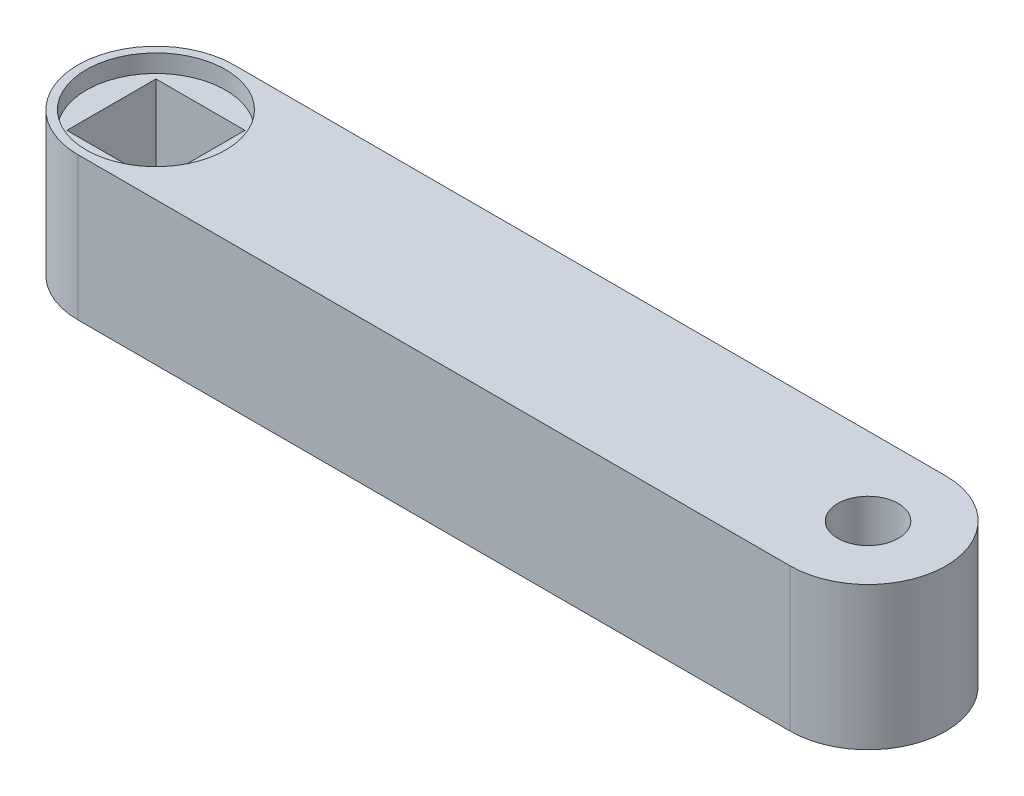
from build123d import *

# Parameters (mm, degrees)
BOSS_EXTRUDE1_DEPTH = 10.2108
SKETCH2_R           = 2.159
SKETCH2_W           = 6.35
SKETCH2_H           = 6.35
CUT_EXTRUDE1_DEPTH  = 58.542673424
SKETCH3_R           = 4.97205
CUT_EXTRUDE2_DEPTH  = 1.27


with BuildPart() as part:
    # Sketch1 → Boss-Extrude1 (new body)
    with BuildSketch(Plane(origin=(0, 0, 0), x_dir=(1, 0, 0), z_dir=(0, 1, 0))):
        with BuildLine():
            Line((0, 5.55625), (50.8, 5.55625))
            ThreePointArc((50.8, 5.55625), (56.35625, 0), (50.8, -5.55625))
            Line((50.8, -5.55625), (0, -5.55625))
            ThreePointArc((0, -5.55625), (-5.55625, 0), (0, 5.55625))
        make_face()
    extrude(amount=BOSS_EXTRUDE1_DEPTH)

    # Sketch2 → Cut-Extrude1 (cut, through all)
    with BuildSketch(Plane(origin=(0, 10.2108, 0), x_dir=(1, 0, 0), z_dir=(0, 1, 0))):
        with Locations(Location((50.8, 0, 0), (0, 0, 270))):
            Circle(SKETCH2_R)
        Rectangle(SKETCH2_W, SKETCH2_H)
    extrude(amount=-CUT_EXTRUDE1_DEPTH, mode=Mode.SUBTRACT)

    # Sketch3 → Cut-Extrude2 (cut)
    with BuildSketch(Plane(origin=(0, 10.2108, 0), x_dir=(1, 0, 0), z_dir=(0, 1, 0))):
        with Locations(Location((0, 0, 0), (0, 0, 270))):
            Circle(SKETCH3_R)
    cut_extrude2 = extrude(amount=-CUT_EXTRUDE2_DEPTH, mode=Mode.SUBTRACT)

    # Mirror1: Cut-Extrude2 across plane
    add(cut_extrude2.mirror(Plane.ZX.offset(5.1054)), mode=Mode.SUBTRACT)


solid = part.part
